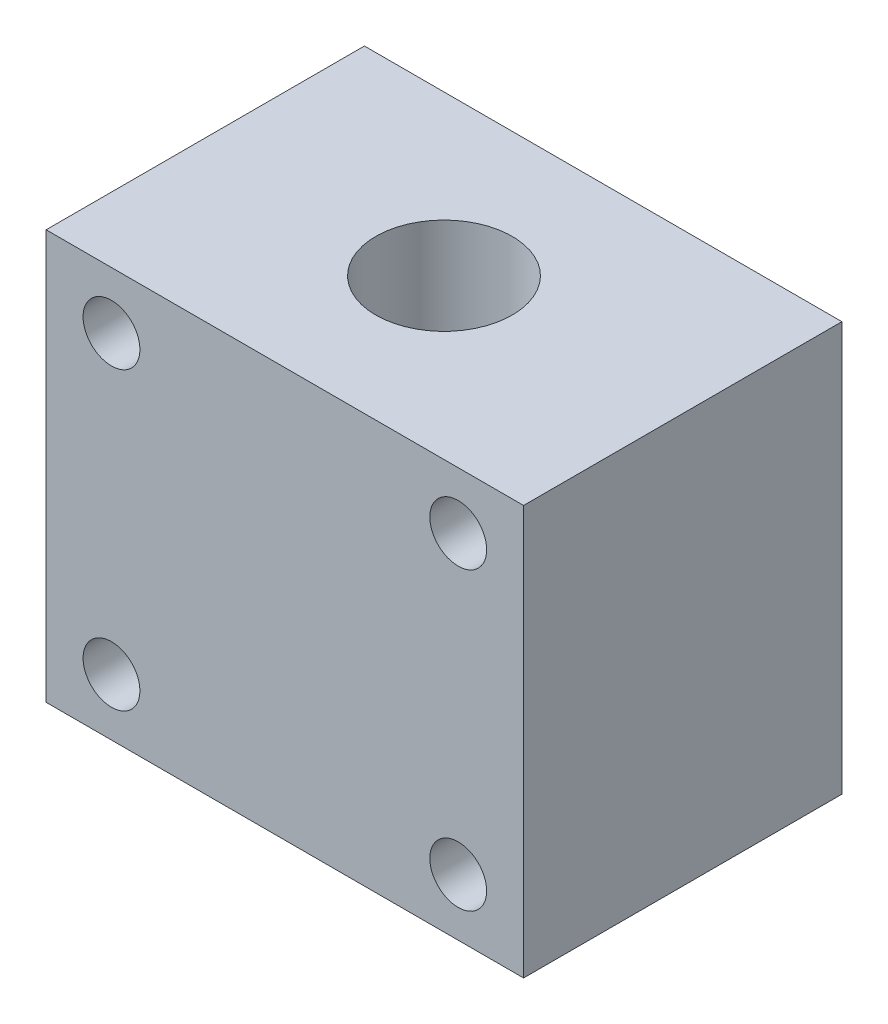
from build123d import *

# Parameters (mm, degrees)
SKETCH_1_W               = 42
SKETCH_1_H               = 28
SKETCH_1_R               = 6
EXTRUDE_2_DEPTH          = 18
EXTRUDE_START            = -18
SKETCH_1_2_W             = 42
SKETCH_1_2_H             = 28
SKETCH_1_2_R             = 6
EXTRUDE_3_DEPTH          = 18
CUT_EXTRUDE_3_DEPTH      = 32
CUT_EXTRUDE_3_DEPTH_BACK = 32
SKETCH_3_R               = 2.5


with BuildPart() as part:
    # 草图1 → 凸台-拉伸2 (new body)
    with BuildSketch(Plane(origin=(0, 0, 0), x_dir=(1, 0, 0), z_dir=(0, 1, 0))):
        Rectangle(SKETCH_1_W, SKETCH_1_H)
        Circle(SKETCH_1_R, mode=Mode.SUBTRACT)
    extrude(amount=EXTRUDE_2_DEPTH)

    # 草图1<2> → 凸台-拉伸3 (add)
    with BuildSketch(Plane(origin=(0, 0, 0), x_dir=(1, 0, 0), z_dir=(0, 1, 0)).offset(EXTRUDE_START)):
        Rectangle(SKETCH_1_2_W, SKETCH_1_2_H)
        Circle(SKETCH_1_2_R, mode=Mode.SUBTRACT)
    extrude(amount=EXTRUDE_3_DEPTH)

    # 草图3 → 切除-拉伸3 (cut, two sides: drawn at the far end of the back side and taken through both)
    with BuildSketch(Plane.XY.offset(-CUT_EXTRUDE_3_DEPTH_BACK)):
        with Locations((15.25, 13)):
            Circle(SKETCH_3_R)
        with Locations((-15.25, 13)):
            Circle(SKETCH_3_R)
        with Locations((15.25, -13)):
            Circle(SKETCH_3_R)
        with Locations((-15.25, -13)):
            Circle(SKETCH_3_R)
    extrude(amount=CUT_EXTRUDE_3_DEPTH + CUT_EXTRUDE_3_DEPTH_BACK, mode=Mode.SUBTRACT)


solid = part.part
